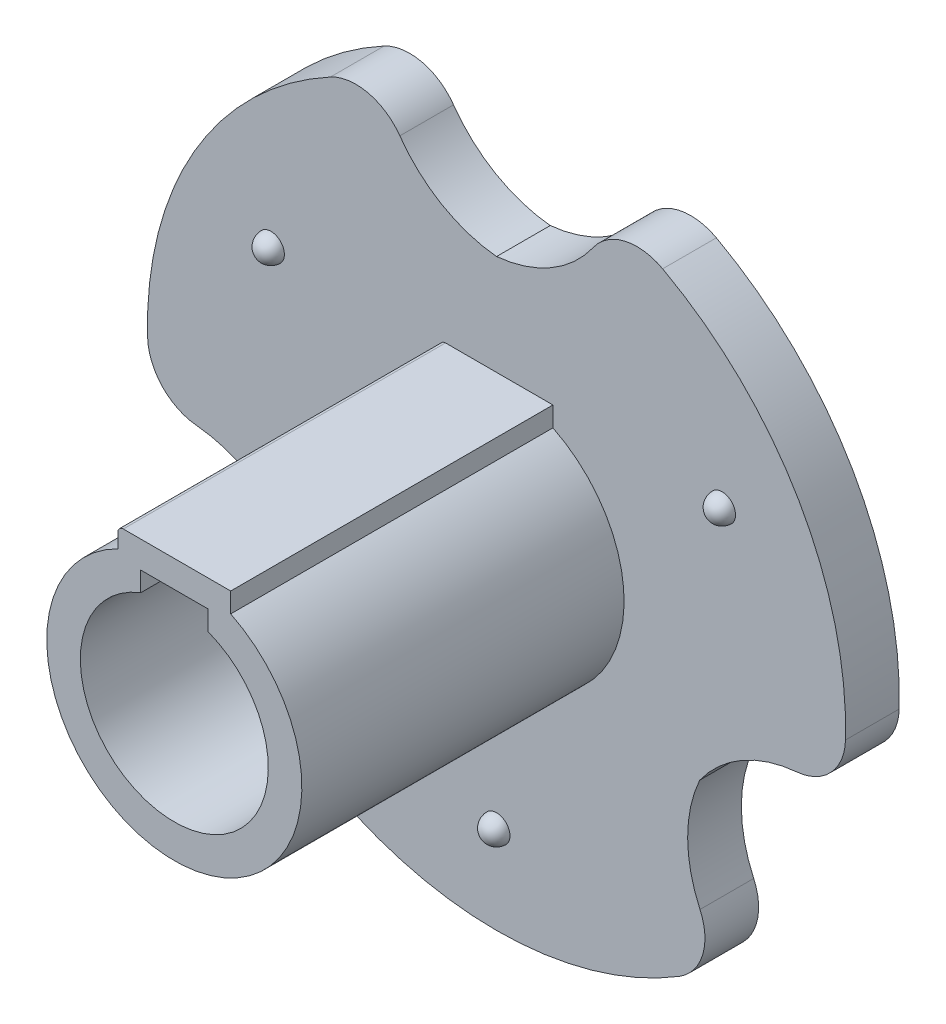
from build123d import *

# Parameters (mm, degrees)
BOSS_EXTRU_1_DEPTH           = 12
ESQUISSE3_R                  = 13
BOSS_EXTRU_5_DEPTH           = 2
BOSS_EXTRU_6_START           = 1.1
ESQUISSE4_R                  = 6
ESQUISSE4_R_2                = 4.75
BOSS_EXTRU_6_DEPTH           = 1.1
ENL_V_MAT_EXTRU_2_REACH      = 23.954
CONG_1_R                     = 0.5
CONG_2_R                     = 0.5
ENL_V_MAT_EXTRU_3_REACH      = 25.108
R_P_TITION_CIRCULAIRE1_COUNT = 2
R_P_TITION_CIRCULAIRE1_ANGLE = 120
R_P_TITION_CIRCULAIRE2_COUNT = 2
R_P_TITION_CIRCULAIRE2_ANGLE = 240
CONG_3_R                     = 0.2
R_P_TITION_CIRCULAIRE3_COUNT = 2
R_P_TITION_CIRCULAIRE3_ANGLE = 240
R_P_TITION_CIRCULAIRE4_COUNT = 2
R_P_TITION_CIRCULAIRE4_ANGLE = 120


with BuildPart() as part:
    # Esquisse1 → Boss.-Extru.1 (new body)
    with BuildSketch(Plane.XY):
        with BuildLine():
            Line((-2.1, 5), (2.1, 5))
            Line((2.1, 5), (2.1, 4.260575079))
            ThreePointArc((2.1, 4.260575079), (0, -4.75), (-2.1, 4.260575079))
            Line((-2.1, 4.260575079), (-2.1, 5))
        make_face()
        with BuildLine():
            Line((-1.25, 4), (1.25, 4))
            Line((1.25, 4), (1.25, 3.269174208))
            ThreePointArc((1.25, 3.269174208), (0, -3.5), (-1.25, 3.269174208))
            Line((-1.25, 3.269174208), (-1.25, 4))
        make_face(mode=Mode.SUBTRACT)
    extrude(amount=BOSS_EXTRU_1_DEPTH)

    # Esquisse3 → Boss.-Extru.5 (add)
    with BuildSketch(Plane(origin=(0, 0, 0), x_dir=(-1, 0, 0), z_dir=(0, 0, -1))):
        Circle(ESQUISSE3_R)
    extrude(amount=BOSS_EXTRU_5_DEPTH)

    # Esquisse4 → Boss.-Extru.6 (add)
    with BuildSketch(Plane(origin=(0, 0, -2), x_dir=(-1, 0, 0), z_dir=(0, 0, -1)).offset(BOSS_EXTRU_6_START)):
        Circle(ESQUISSE4_R)
        Circle(ESQUISSE4_R_2, mode=Mode.SUBTRACT)
    extrude(amount=-BOSS_EXTRU_6_DEPTH)

    # Esquisse5 → Enlèv. mat.-Extru.2 (cut, up to next)
    with BuildSketch(Plane.XY, mode=Mode.PRIVATE) as enl_v_mat_extru_2_sk1:
        with BuildLine():
            Line((1.25, 4), (-1.25, 4))
            Line((-1.25, 4), (-1.25, 3.269174208))
            ThreePointArc((-1.25, 3.269174208), (0, -3.5), (1.25, 3.269174208))
            Line((1.25, 3.269174208), (1.25, 4))
        make_face()
    enl_v_mat_extru_2_tool1 = extrude(enl_v_mat_extru_2_sk1.sketch, amount=-ENL_V_MAT_EXTRU_2_REACH, mode=Mode.PRIVATE) & part.part
    add(enl_v_mat_extru_2_tool1.solids().sort_by_distance((0, 0.133717, 0))[0], mode=Mode.SUBTRACT)

    # Congé1
    cong_1_edges = [part.edges().sort_by_distance(p)[0] for p in [
        (6, 0, -3.1),
    ]]
    fillet(cong_1_edges, radius=CONG_1_R)

    # Congé2
    cong_2_edges = [part.edges().sort_by_distance(p)[0] for p in [
        (4.75, 0, -3.1),
    ]]
    fillet(cong_2_edges, radius=CONG_2_R)

    # Esquisse6 → Enlèv. mat.-Extru.3 (cut, up to next)
    with BuildSketch(Plane(origin=(0, 0, -2), x_dir=(-1, 0, 0), z_dir=(0, 0, -1)), mode=Mode.PRIVATE) as enl_v_mat_extru_3_sk1:
        with BuildLine():
            ThreePointArc((3.60109047, 10.828515139), (2.028708414, 9.38979217), (0, 8.736606683))
            ThreePointArc((0, 8.736606683), (-2.028708414, 9.38979217), (-3.60109047, 10.828515139))
            ThreePointArc((-3.60109047, 10.828515139), (-4.778846502, 11.621991896), (-6.186412192, 11.433647895))
            ThreePointArc((-6.186412192, 11.433647895), (0, 13), (6.186412192, 11.433647895))
            ThreePointArc((6.186412192, 11.433647895), (4.778846502, 11.621991896), (3.60109047, 10.828515139))
        make_face()
    enl_v_mat_extru_3_tool1 = extrude(enl_v_mat_extru_3_sk1.sketch, amount=-ENL_V_MAT_EXTRU_3_REACH, mode=Mode.PRIVATE) & part.part
    enl_v_mat_extru_3 = enl_v_mat_extru_3_tool1.solids().sort_by_distance((0, 11.154072, -2))[0]
    add(enl_v_mat_extru_3, mode=Mode.SUBTRACT)

    # Esquisse7 → Révolution2 (revolve)
    with BuildSketch(Plane.XY):
        with BuildLine():
            Line((-0.495343696, -9.631921937), (0.495343696, -9.768078063))
            ThreePointArc((0.495343696, -9.768078063), (0.068078063, -9.204656304), (-0.495343696, -9.631921937))
        make_face()
    r_volution2 = revolve(axis=Axis((-0.495343696, -9.631921937, 0), (0.9906873922487173, -0.1361561267054709, 0)))

    # Répétition circulaire1: Révolution2 ×2 about axis
    r_p_tition_circulaire1_axis = Axis((0, 0, 0), (0, 0, -1))
    for i in range(1, R_P_TITION_CIRCULAIRE1_COUNT):
        add(r_volution2.rotate(r_p_tition_circulaire1_axis, i * R_P_TITION_CIRCULAIRE1_ANGLE / (R_P_TITION_CIRCULAIRE1_COUNT - 1)))

    # Répétition circulaire2: Révolution2 ×2 about axis
    r_p_tition_circulaire2_axis = Axis((0, 0, 0), (0, 0, -1))
    for i in range(1, R_P_TITION_CIRCULAIRE2_COUNT):
        add(r_volution2.rotate(r_p_tition_circulaire2_axis, i * R_P_TITION_CIRCULAIRE2_ANGLE / (R_P_TITION_CIRCULAIRE2_COUNT - 1)))

    # Congé3
    cong_3_edges = [part.edges().sort_by_distance(p)[0] for p in [
        (-2.1, 5, 6),
    ]]
    fillet(cong_3_edges, radius=CONG_3_R)

    # Répétition circulaire3: Enlèv. mat.-Extru.3 ×2 about axis
    r_p_tition_circulaire3_axis = Axis((0, 0, 0), (0, 0, -1))
    for i in range(1, R_P_TITION_CIRCULAIRE3_COUNT):
        add(enl_v_mat_extru_3.rotate(r_p_tition_circulaire3_axis, i * R_P_TITION_CIRCULAIRE3_ANGLE / (R_P_TITION_CIRCULAIRE3_COUNT - 1)), mode=Mode.SUBTRACT)

    # Répétition circulaire4: Enlèv. mat.-Extru.3 ×2 about axis
    r_p_tition_circulaire4_axis = Axis((0, 0, 0), (0, 0, -1))
    for i in range(1, R_P_TITION_CIRCULAIRE4_COUNT):
        add(enl_v_mat_extru_3.rotate(r_p_tition_circulaire4_axis, i * R_P_TITION_CIRCULAIRE4_ANGLE / (R_P_TITION_CIRCULAIRE4_COUNT - 1)), mode=Mode.SUBTRACT)


solid = part.part
